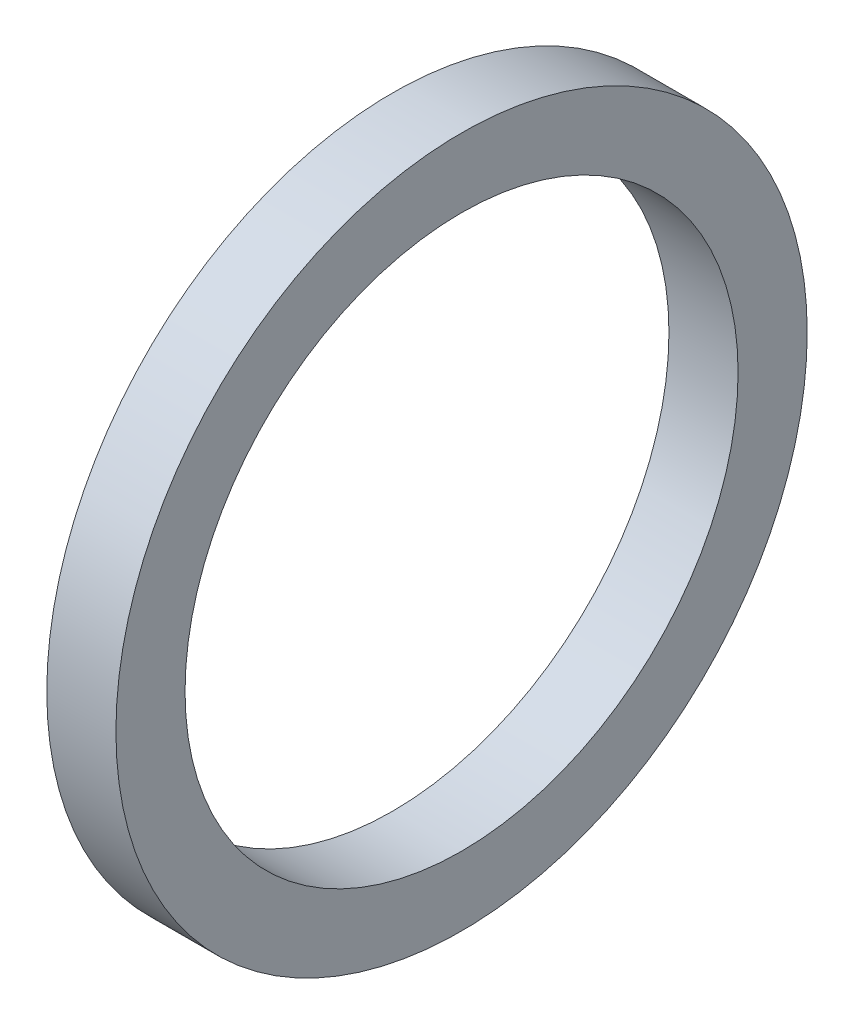
from build123d import *

# Parameters (mm, degrees)
SKETCH_1_R      = 5
SKETCH_1_R_2    = 4
EXTRUDE_1_DEPTH = 1


with BuildPart() as part:
    # Эскиз1 → Бобышка-Вытянуть1 (new body)
    with BuildSketch(Plane(origin=(0, 0, 0), x_dir=(0, 0, -1), z_dir=(1, 0, 0))):
        Circle(SKETCH_1_R)
        Circle(SKETCH_1_R_2, mode=Mode.SUBTRACT)
    extrude(amount=EXTRUDE_1_DEPTH)


solid = part.part
